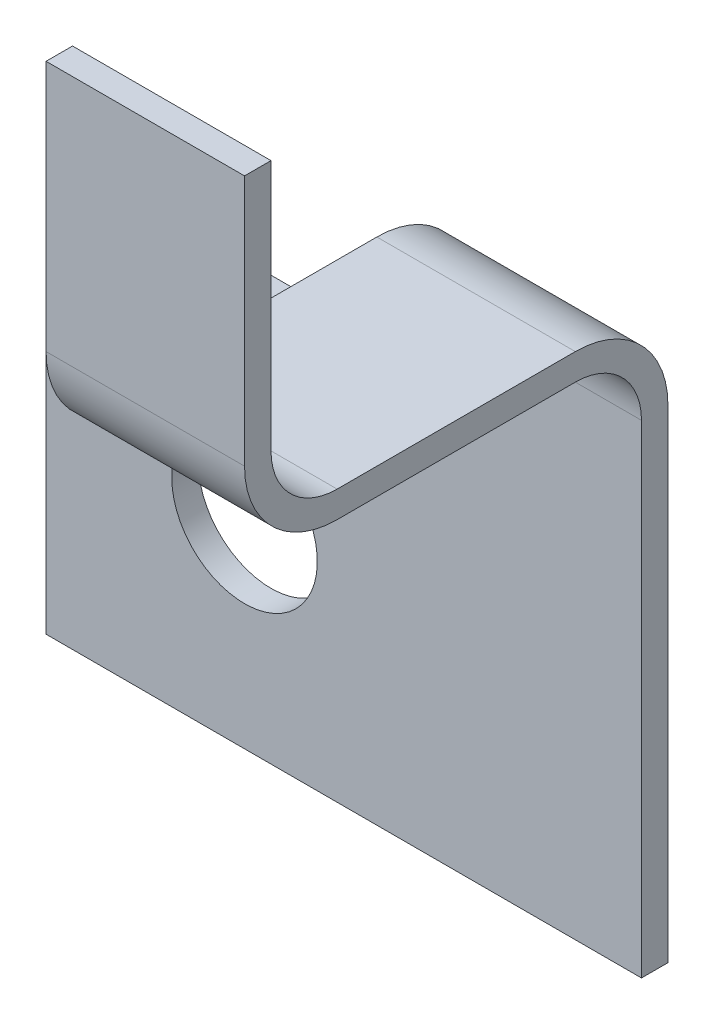
from build123d import *

# Parameters (mm, degrees)
SKETCH1_W           = 12.8
SKETCH1_H           = 27
BOSS_EXTRUDE1_DEPTH = 6
SKETCH2_W           = 12
SKETCH2_H           = 16.6
CUT_EXTRUDE1_DEPTH  = 258.649269937
SKETCH3_W           = 0.8
SKETCH3_H           = 12
BOSS_EXTRUDE2_DEPTH = 12
SKETCH4_W           = 12
SKETCH4_H           = 9.6
CUT_EXTRUDE2_DEPTH  = 258.858772003
HOLE1_D             = 4.4
HOLE1_DEPTH         = 12.8
FILLET1_R           = 2
FILLET2_R           = 2
FILLET3_R           = 2.8
FILLET4_R           = 2.8


with BuildPart() as part:
    # Sketch1 → Boss-Extrude1 (new body)
    with BuildSketch(Plane(origin=(27.999999016, 0, 0), x_dir=(0, 0, -1), z_dir=(1, 0, 0))):
        with Locations((-19.400000091, -242.784034412)):
            Rectangle(SKETCH1_W, SKETCH1_H)
    extrude(amount=-BOSS_EXTRUDE1_DEPTH)

    # Sketch2 → Cut-Extrude1 (cut, through all)
    with BuildSketch(Plane(origin=(27.999999016, 0, 0), x_dir=(0, 0, -1), z_dir=(1, 0, 0))):
        with Locations((-19.800000091, -247.984034412)):
            Rectangle(SKETCH2_W, SKETCH2_H)
    extrude(amount=-CUT_EXTRUDE1_DEPTH, mode=Mode.SUBTRACT)

    # Sketch3 → Boss-Extrude2 (add)
    with BuildSketch(Plane.ZY.offset(-21.999999016)):
        with Locations((13.400000091, -250.284034412)):
            Rectangle(SKETCH3_W, SKETCH3_H)
    extrude(amount=BOSS_EXTRUDE2_DEPTH)

    # Sketch4 → Cut-Extrude2 (cut, through all)
    with BuildSketch(Plane.ZY.offset(-21.999999016)):
        with Locations((19.000000091, -234.084034412)):
            Rectangle(SKETCH4_W, SKETCH4_H)
    extrude(amount=-CUT_EXTRUDE2_DEPTH, mode=Mode.SUBTRACT)

    # Hole1
    with Locations(Plane(origin=(0, 0, 13.000000091), x_dir=(-1, 0, 0), z_dir=(0, 0, -1))):
        with Locations((-15.999999016, -250.284034412)):
            Hole(HOLE1_D / 2, depth=HOLE1_DEPTH)

    # Fillet1
    fillet1_edges = [part.edges().sort_by_distance(p)[0] for p in [
        (24.999999016, -239.684034412, 13.800000091),
    ]]
    fillet(fillet1_edges, radius=FILLET1_R)

    # Fillet2
    fillet2_edges = [part.edges().sort_by_distance(p)[0] for p in [
        (24.999999016, -238.884034412, 25.000000091),
    ]]
    fillet(fillet2_edges, radius=FILLET2_R)

    # Fillet3
    fillet3_edges = [part.edges().sort_by_distance(p)[0] for p in [
        (24.999999016, -239.684034412, 25.800000091),
    ]]
    fillet(fillet3_edges, radius=FILLET3_R)

    # Fillet4
    fillet4_edges = [part.edges().sort_by_distance(p)[0] for p in [
        (24.999999016, -238.884034412, 13.000000091),
    ]]
    fillet(fillet4_edges, radius=FILLET4_R)


solid = part.part
